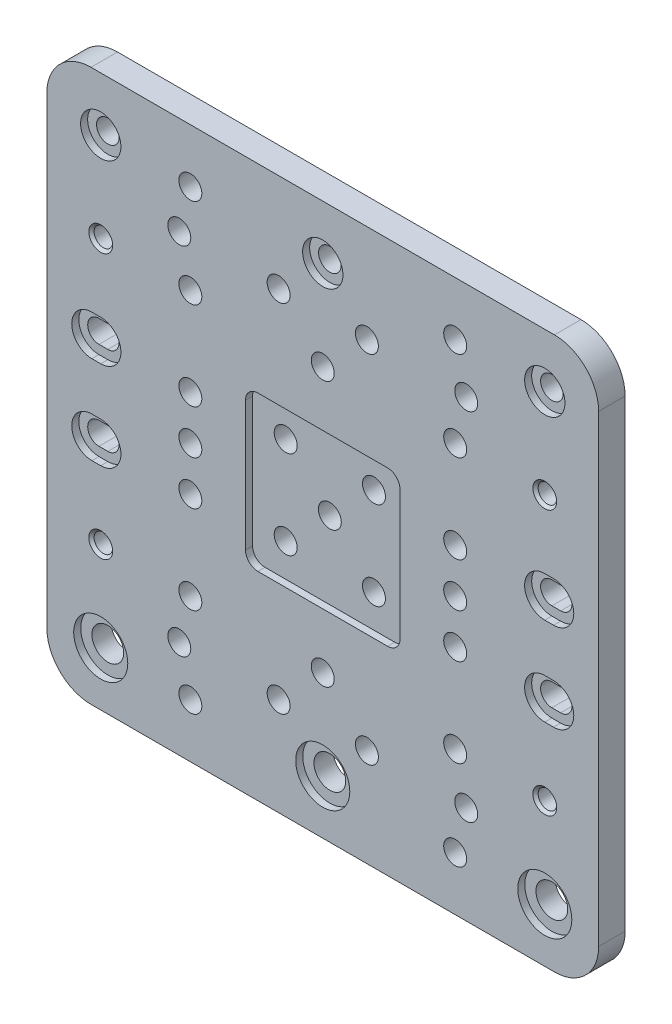
from build123d import *

# Parameters (mm, degrees)
SKETCH1_W             = 125
SKETCH1_H             = 125
BOSS_EXTRUDE1_DEPTH   = 6
M5_CLEARANCE_HOLE1_D  = 5.2
SKETCH4_R             = 2.55
SKETCH4_R_2           = 3.6
CUT_EXTRUDE1_DEPTH    = 89.591760339
SKETCH5_R             = 4.5675
SKETCH5_R_2           = 6.125
SKETCH5_W             = 35
SKETCH5_H             = 35
CUT_EXTRUDE2_DEPTH    = 1.6
FILLET1_R             = 10
FILLET2_R             = 2.8
M5X0_8_TAPPED_HOLE1_D = 4.2
CHAMFER1_SIZE         = 0.6


with BuildPart() as part:
    # Sketch1 → Boss-Extrude1 (new body)
    with BuildSketch(Plane.XY):
        Rectangle(SKETCH1_W, SKETCH1_H)
    extrude(amount=BOSS_EXTRUDE1_DEPTH)

    # M5 Clearance Hole1 (through all)
    with Locations(Plane.XY.offset(6)):
        with Locations((0, 0), (-10, 10), (-30, 30), (0, 30), (-30, 0), (-30, 10), (-30, -10), (0, -30), (-30, -30), (-10, -10), (10, -10), (30, -30), (30, -10), (30, 10), (30, 0), (30, 30), (10, 10), (-30, 50.3), (-32.5, 40.3), (-10, 40.3), (10, 40.3), (32.5, 40.3), (30, 50.3), (30, -50.3), (32.5, -40.3), (10, -40.3), (-10, -40.3), (-32.5, -40.3), (-30, -50.3)):
            Hole(M5_CLEARANCE_HOLE1_D / 2)

    # Sketch4 → Cut-Extrude1 (cut, through all)
    with BuildSketch(Plane.XY.offset(6)):
        with Locations((-50.3, 50.3)):
            Circle(SKETCH4_R)
        with Locations((0, 50.3)):
            Circle(SKETCH4_R)
        with Locations((-50.3, -50.3)):
            Circle(SKETCH4_R_2)
        with Locations(Location((50.3, 50.3, 0), (0, 0, 180))):
            Circle(SKETCH4_R)
        with Locations(Location((50.3, -50.3, 0), (0, 0, 180))):
            Circle(SKETCH4_R_2)
        with Locations((0, -50.3)):
            Circle(SKETCH4_R_2)
        with BuildLine():
            Line((-50.3, 7.45), (-52.3, 7.45))
            ThreePointArc((-52.3, 7.45), (-54.85, 10), (-52.3, 12.55))
            Line((-52.3, 12.55), (-50.3, 12.55))
            ThreePointArc((-50.3, 12.55), (-47.75, 10), (-50.3, 7.45))
        make_face()
        with BuildLine():
            Line((-50.3, -7.45), (-52.3, -7.45))
            ThreePointArc((-52.3, -7.45), (-54.85, -10), (-52.3, -12.55))
            Line((-52.3, -12.55), (-50.3, -12.55))
            ThreePointArc((-50.3, -12.55), (-47.75, -10), (-50.3, -7.45))
        make_face()
        with BuildLine():
            Line((50.3, 7.45), (52.3, 7.45))
            ThreePointArc((52.3, 7.45), (54.85, 10), (52.3, 12.55))
            Line((52.3, 12.55), (50.3, 12.55))
            ThreePointArc((50.3, 12.55), (47.75, 10), (50.3, 7.45))
        make_face()
        with BuildLine():
            Line((50.3, -7.45), (52.3, -7.45))
            ThreePointArc((52.3, -7.45), (54.85, -10), (52.3, -12.55))
            Line((52.3, -12.55), (50.3, -12.55))
            ThreePointArc((50.3, -12.55), (47.75, -10), (50.3, -7.45))
        make_face()
    extrude(amount=-CUT_EXTRUDE1_DEPTH, mode=Mode.SUBTRACT)

    # Sketch5 → Cut-Extrude2 (cut)
    with BuildSketch(Plane.XY.offset(6)):
        with Locations((-50.3, 50.3)):
            Circle(SKETCH5_R)
        with Locations((0, 50.3)):
            Circle(SKETCH5_R)
        with Locations((50.3, 50.3)):
            Circle(SKETCH5_R)
        with Locations((-50.3, -50.3)):
            Circle(SKETCH5_R_2)
        with Locations((0, -50.3)):
            Circle(SKETCH5_R_2)
        with Locations((50.3, -50.3)):
            Circle(SKETCH5_R_2)
        Rectangle(SKETCH5_W, SKETCH5_H)
        with BuildLine():
            Line((-50.3, 5.432), (-52.3, 5.432))
            ThreePointArc((-52.3, 5.432), (-56.868, 10), (-52.3, 14.568))
            Line((-52.3, 14.568), (-50.3, 14.568))
            ThreePointArc((-50.3, 14.568), (-45.732, 10), (-50.3, 5.432))
        make_face()
        with BuildLine():
            Line((-50.3, -14.568), (-52.3, -14.568))
            ThreePointArc((-52.3, -14.568), (-56.868, -10), (-52.3, -5.432))
            Line((-52.3, -5.432), (-50.3, -5.432))
            ThreePointArc((-50.3, -5.432), (-45.732, -10), (-50.3, -14.568))
        make_face()
        with BuildLine():
            Line((50.3, 14.568), (52.3, 14.568))
            ThreePointArc((52.3, 14.568), (56.868, 10), (52.3, 5.432))
            Line((52.3, 5.432), (50.3, 5.432))
            ThreePointArc((50.3, 5.432), (45.732, 10), (50.3, 14.568))
        make_face()
        with BuildLine():
            Line((50.3, -5.432), (52.3, -5.432))
            ThreePointArc((52.3, -5.432), (56.868, -10), (52.3, -14.568))
            Line((52.3, -14.568), (50.3, -14.568))
            ThreePointArc((50.3, -14.568), (45.732, -10), (50.3, -5.432))
        make_face()
    extrude(amount=-CUT_EXTRUDE2_DEPTH, mode=Mode.SUBTRACT)

    # Fillet1
    fillet1_edges = [part.edges().sort_by_distance(p)[0] for p in [
        (-62.5, 62.5, 3),
        (62.5, 62.5, 3),
        (62.5, -62.5, 3),
        (-62.5, -62.5, 3),
    ]]
    fillet(fillet1_edges, radius=FILLET1_R)

    # Fillet2
    fillet2_edges = [part.edges().sort_by_distance(p)[0] for p in [
        (-17.5, -17.5, 5.2),
        (-17.5, 17.5, 5.2),
        (17.5, 17.5, 5.2),
        (17.5, -17.5, 5.2),
    ]]
    fillet(fillet2_edges, radius=FILLET2_R)

    # M5x0.8 Tapped Hole1 (through all)
    with Locations(Plane.XY.offset(6)):
        with Locations((-50.3, 30), (50.3, 30), (50.3, -30), (-50.3, -30)):
            Hole(M5X0_8_TAPPED_HOLE1_D / 2)

    # Chamfer1
    chamfer1_edges = [part.edges().sort_by_distance(p)[0] for p in [
        (-48.2, -30, 6),
        (52.4, -30, 6),
        (52.4, 30, 6),
        (-48.2, 30, 6),
    ]]
    chamfer(chamfer1_edges, length=CHAMFER1_SIZE)


solid = part.part
